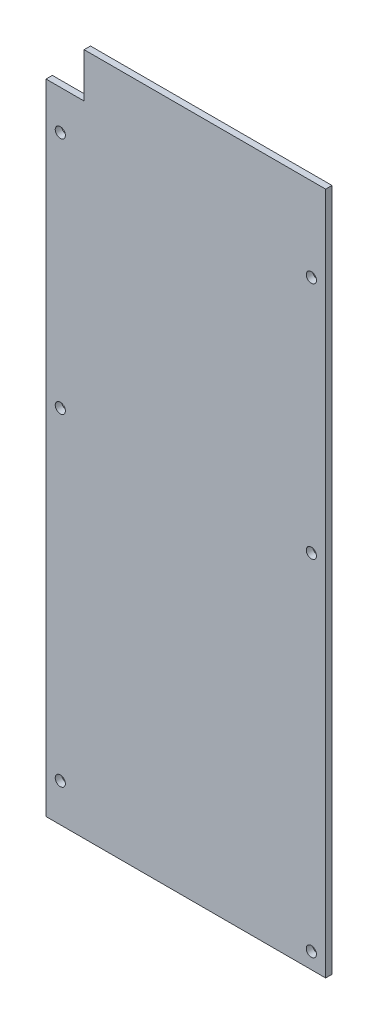
from build123d import *

# Parameters (mm, degrees)
SKETCH1_R           = 1.6
BOSS_EXTRUDE1_DEPTH = 2


with BuildPart() as part:
    # Sketch1 → Boss-Extrude1 (new body)
    with BuildSketch(Plane.XY):
        Polygon((0, 201), (0, 0), (88, 0), (88, 215), (12, 215), (12, 201), align=None)
        with Locations((4.5, 12)):
            Circle(SKETCH1_R, mode=Mode.SUBTRACT)
        with Locations((83.5, 5)):
            Circle(SKETCH1_R, mode=Mode.SUBTRACT)
        with Locations((4.5, 113.59)):
            Circle(SKETCH1_R, mode=Mode.SUBTRACT)
        with Locations((4.5, 188.68)):
            Circle(SKETCH1_R, mode=Mode.SUBTRACT)
        with Locations((83.5, 113.59)):
            Circle(SKETCH1_R, mode=Mode.SUBTRACT)
        with Locations((83.5, 188.68)):
            Circle(SKETCH1_R, mode=Mode.SUBTRACT)
    extrude(amount=BOSS_EXTRUDE1_DEPTH)


solid = part.part
